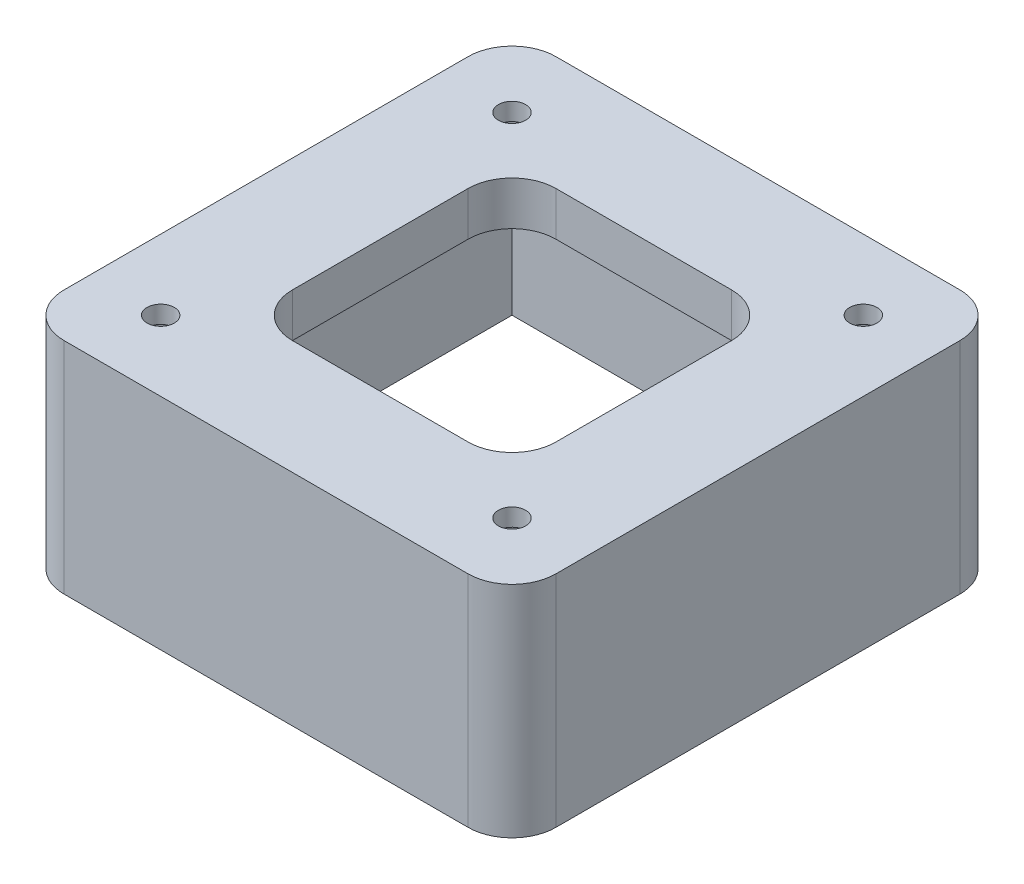
from build123d import *

# Parameters (mm, degrees)
SKETCH1_W           = 56
SKETCH1_H           = 56
SKETCH1_R           = 1.55
SKETCH1_W_2         = 30
SKETCH1_H_2         = 30
BOSS_EXTRUDE1_DEPTH = 5
SKETCH2_R           = 3.55
CUT_EXTRUDE1_DEPTH  = 3
FILLET1_R           = 5
SKETCH3_W           = 56
SKETCH3_H           = 56
SKETCH3_W_2         = 50
SKETCH3_H_2         = 50
BOSS_EXTRUDE2_DEPTH = 20
FILLET2_R           = 5


with BuildPart() as part:
    # Sketch1 → Boss-Extrude1 (new body)
    with BuildSketch(Plane(origin=(0, 0, 0), x_dir=(1, 0, 0), z_dir=(0, 1, 0))):
        Rectangle(SKETCH1_W, SKETCH1_H)
        with Locations(Location((-20, 20, 0), (0, 0, 270))):
            Circle(SKETCH1_R, mode=Mode.SUBTRACT)
        with Locations(Location((20, 20, 0), (0, 0, 270))):
            Circle(SKETCH1_R, mode=Mode.SUBTRACT)
        with Locations(Location((20, -20, 0), (0, 0, 270))):
            Circle(SKETCH1_R, mode=Mode.SUBTRACT)
        with Locations(Location((-20, -20, 0), (0, 0, 270))):
            Circle(SKETCH1_R, mode=Mode.SUBTRACT)
        Rectangle(SKETCH1_W_2, SKETCH1_H_2, mode=Mode.SUBTRACT)
    extrude(amount=BOSS_EXTRUDE1_DEPTH)

    # Sketch2 → Cut-Extrude1 (cut)
    with BuildSketch(Plane.XZ):
        with Locations(Location((-20, 20, 0), (0, 0, 270))):
            Circle(SKETCH2_R)
        with Locations(Location((20, 20, 0), (0, 0, 270))):
            Circle(SKETCH2_R)
        with Locations(Location((-20, -20, 0), (0, 0, 270))):
            Circle(SKETCH2_R)
        with Locations(Location((20, -20, 0), (0, 0, 270))):
            Circle(SKETCH2_R)
    extrude(amount=-CUT_EXTRUDE1_DEPTH, mode=Mode.SUBTRACT)

    # Fillet1
    fillet1_edges = [part.edges().sort_by_distance(p)[0] for p in [
        (15, 2.5, 15),
        (15, 2.5, -15),
        (-15, 2.5, -15),
        (-15, 2.5, 15),
    ]]
    fillet(fillet1_edges, radius=FILLET1_R)

    # Sketch3 → Boss-Extrude2 (add)
    with BuildSketch(Plane.XZ):
        Rectangle(SKETCH3_W, SKETCH3_H)
        Rectangle(SKETCH3_W_2, SKETCH3_H_2, mode=Mode.SUBTRACT)
    extrude(amount=BOSS_EXTRUDE2_DEPTH)

    # Fillet2
    fillet2_edges = [part.edges().sort_by_distance(p)[0] for p in [
        (-28, -7.5, -28),
        (28, -7.5, -28),
        (28, -7.5, 28),
        (-28, -7.5, 28),
    ]]
    fillet(fillet2_edges, radius=FILLET2_R)


solid = part.part
